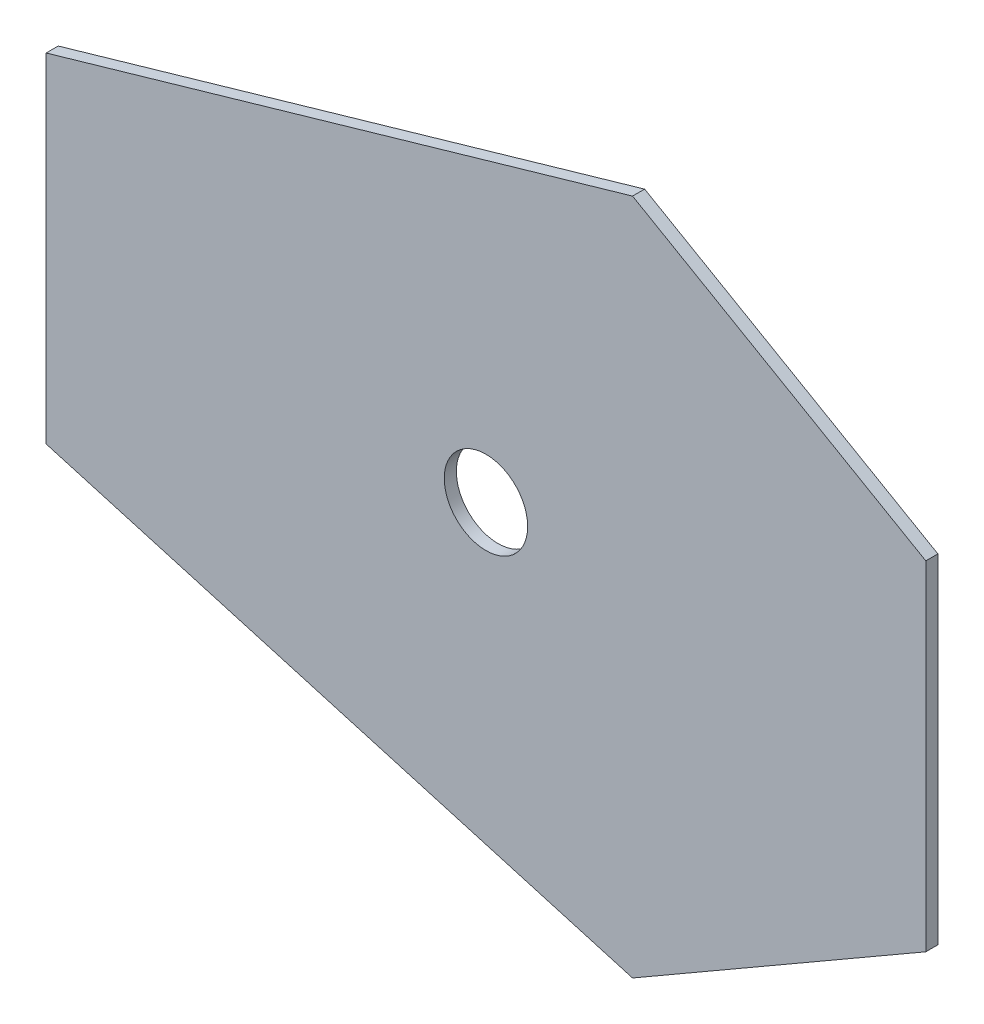
from build123d import *

# Parameters (mm, degrees)
SKETCH1_R           = 3.45
BOSS_EXTRUDE1_DEPTH = 1


with BuildPart() as part:
    # Sketch1 → Boss-Extrude1 (new body)
    with BuildSketch(Plane.XY):
        Polygon((-41.523066959, -14), (6.974355653, -28), (31.223066959, -14), (31.223066959, 14), (6.974355653, 28), (-41.523066959, 14), align=None)
        with Locations((-5.15, 0)):
            Circle(SKETCH1_R, mode=Mode.SUBTRACT)
    extrude(amount=BOSS_EXTRUDE1_DEPTH)


solid = part.part
